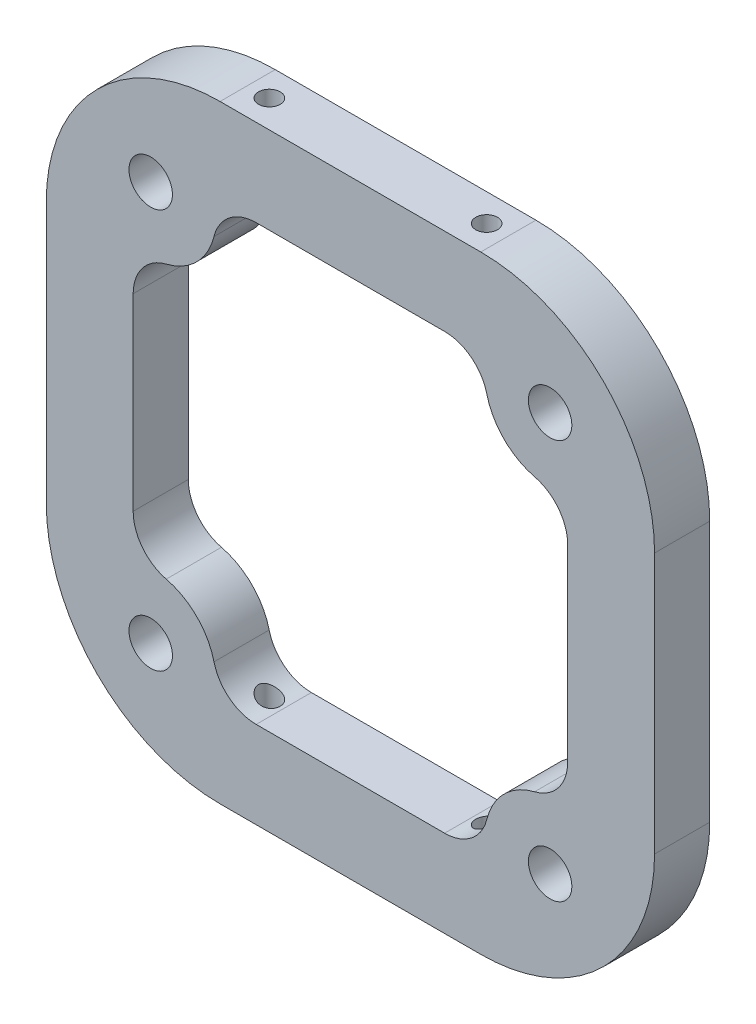
from build123d import *

# Parameters (mm, degrees)
SKETCH1_W                             = 70
SKETCH1_H                             = 70
F_125_IN_SHEET_DEPTH                  = 3.175
FILLET1_R                             = 5
FILLET2_R                             = 20
F_5_0_REAMED_OVER_FOR_SHOULDER_BOLT_D = 5
M3X0_5_TAPPED_HOLE1_REACH             = 80.327
M3X0_5_TAPPED_HOLE1_BORE_R            = 1.25


with BuildPart() as part:
    # Sketch1 → .125 in sheet (new, symmetric)
    with BuildSketch(Plane.XY):
        Rectangle(SKETCH1_W, SKETCH1_H)
        with BuildLine():
            Line((-15.75784645, 25), (15.75784645, 25))
            ThreePointArc((15.75784645, 25), (17.67766953, 17.67766953), (25, 15.75784645))
            Line((25, 15.75784645), (25, -15.75784645))
            ThreePointArc((25, -15.75784645), (17.67766953, -17.67766953), (15.75784645, -25))
            Line((15.75784645, -25), (-15.75784645, -25))
            ThreePointArc((-15.75784645, -25), (-17.67766953, -17.67766953), (-25, -15.75784645))
            Line((-25, -15.75784645), (-25, 15.75784645))
            ThreePointArc((-25, 15.75784645), (-17.67766953, 17.67766953), (-15.75784645, 25))
        make_face(mode=Mode.SUBTRACT)
    extrude(amount=F_125_IN_SHEET_DEPTH, both=True)

    # Fillet1
    fillet1_edges = [part.edges().sort_by_distance(p)[0] for p in [
        (25, 15.75784645, 0),
        (15.75784645, 25, 0),
        (-15.75784645, 25, 0),
        (-25, 15.75784645, 0),
        (-25, -15.75784645, 0),
        (-15.75784645, -25, 0),
        (15.75784645, -25, 0),
        (25, -15.75784645, 0),
    ]]
    fillet(fillet1_edges, radius=FILLET1_R)

    # Fillet2
    fillet2_edges = [part.edges().sort_by_distance(p)[0] for p in [
        (-35, -35, 0),
        (-35, 35, 0),
        (35, 35, 0),
        (35, -35, 0),
    ]]
    fillet(fillet2_edges, radius=FILLET2_R)

    # Ø5.0 Reamed over for shoulder bolt (through all)
    with Locations(Plane(origin=(-38.607659372, 4.370839302, 3.175), x_dir=(1, 0, 0), z_dir=(0, 0, 1))):
        with Locations((15.626688983, 18.610131087), (61.58862976, 18.610131087), (61.58862976, -27.35180969), (15.626688983, -27.35180969)):
            Hole(F_5_0_REAMED_OVER_FOR_SHOULDER_BOLT_D / 2)

    # M3x0.5 Tapped Hole1 bore → M3x0.5 Tapped Hole1 (cut, up to next)
    with BuildSketch(Plane(origin=(0, 35, 0), x_dir=(1, 0, 0), z_dir=(0, 1, 0)), mode=Mode.PRIVATE) as m3x0_5_tapped_hole1_sk1:
        with Locations((-12.5, 0)):
            Circle(M3X0_5_TAPPED_HOLE1_BORE_R)
    m3x0_5_tapped_hole1_tool1 = extrude(m3x0_5_tapped_hole1_sk1.sketch, amount=-M3X0_5_TAPPED_HOLE1_REACH, mode=Mode.PRIVATE) & part.part
    # M3x0.5 Tapped Hole1 bore → M3x0.5 Tapped Hole1 (cut, up to next)
    with BuildSketch(Plane(origin=(0, 35, 0), x_dir=(1, 0, 0), z_dir=(0, 1, 0)), mode=Mode.PRIVATE) as m3x0_5_tapped_hole1_sk2:
        with Locations((12.5, 0)):
            Circle(M3X0_5_TAPPED_HOLE1_BORE_R)
    m3x0_5_tapped_hole1_tool2 = extrude(m3x0_5_tapped_hole1_sk2.sketch, amount=-M3X0_5_TAPPED_HOLE1_REACH, mode=Mode.PRIVATE) & part.part
    m3x0_5_tapped_hole1_1 = m3x0_5_tapped_hole1_tool1.solids().sort_by_distance((-12.5, 35, 0))[0]
    add(m3x0_5_tapped_hole1_1, mode=Mode.SUBTRACT)
    m3x0_5_tapped_hole1_2 = m3x0_5_tapped_hole1_tool2.solids().sort_by_distance((12.5, 35, 0))[0]
    add(m3x0_5_tapped_hole1_2, mode=Mode.SUBTRACT)
    m3x0_5_tapped_hole1 = m3x0_5_tapped_hole1_1 + m3x0_5_tapped_hole1_2  # M3x0.5 Tapped Hole1 as one shape, for the pattern or mirror that repeats it

    # Mirror1: M3x0.5 Tapped Hole1 across plane
    add(m3x0_5_tapped_hole1.mirror(Plane.ZX), mode=Mode.SUBTRACT)


solid = part.part
